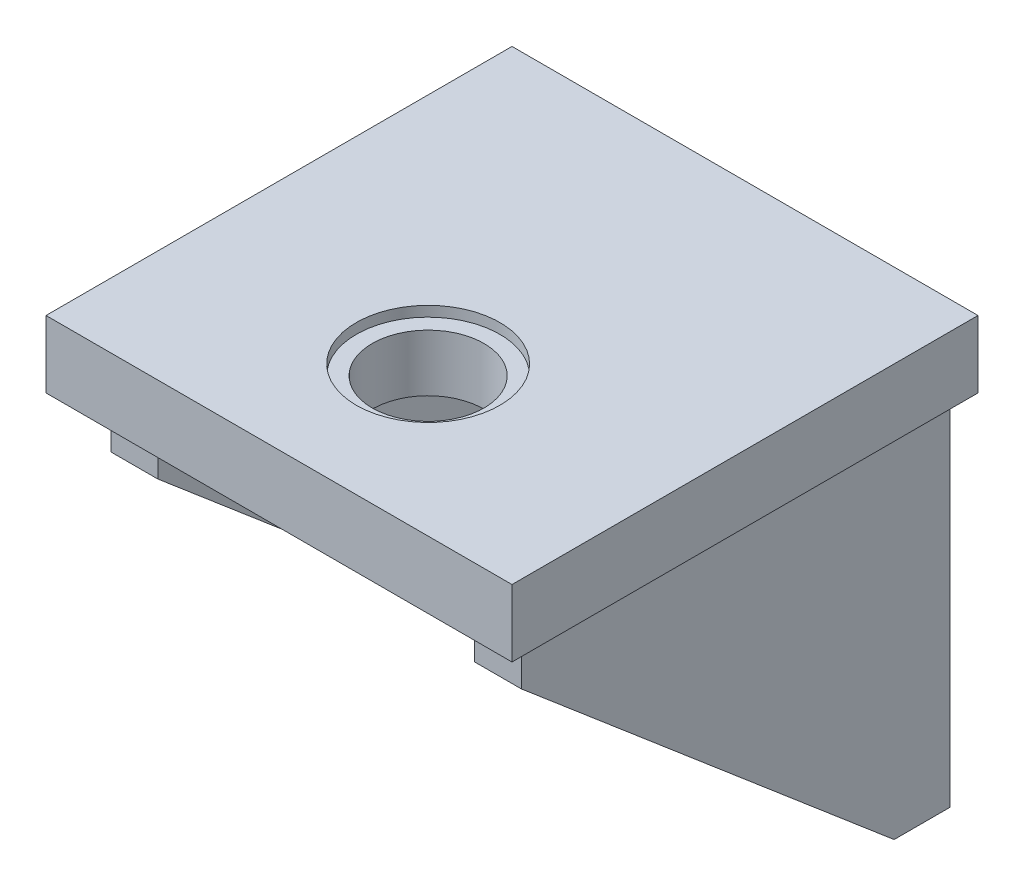
from build123d import *

# Parameters (mm, degrees)
SKETCH_1_W          = 250
SKETCH_1_H          = 250
EXTRUDE_1_DEPTH     = 36
CUT_EXTRUDE_1_REACH = 357.381
SKETCH_2_R          = 30
SKETCH_3_R          = 38.5
CUT_EXTRUDE_2_DEPTH = 5.5
SKETCH_4_W          = 25
SKETCH_4_H          = 230
EXTRUDE_2_DEPTH     = 200
CUT_EXTRUDE_3_REACH = 399.146


with BuildPart() as part:
    # 草图1 → 凸台-拉伸1 (new body)
    with BuildSketch(Plane(origin=(0, 0, 0), x_dir=(1, 0, 0), z_dir=(0, 1, 0))):
        with Locations((125, -125)):
            Rectangle(SKETCH_1_W, SKETCH_1_H)
    extrude(amount=EXTRUDE_1_DEPTH)

    # 草图2 → 切除-拉伸1 (cut, up to next)
    with BuildSketch(Plane(origin=(0, 36, 0), x_dir=(1, 0, 0), z_dir=(0, 1, 0)), mode=Mode.PRIVATE) as cut_extrude_1_sk1:
        with Locations(Location((125, -170, 0), (0, 0, 270))):
            Circle(SKETCH_2_R)
    cut_extrude_1_tool1 = extrude(cut_extrude_1_sk1.sketch, amount=-CUT_EXTRUDE_1_REACH, mode=Mode.PRIVATE) & part.part
    add(cut_extrude_1_tool1.solids().sort_by_distance((125, 36, 170))[0], mode=Mode.SUBTRACT)

    # 草图3 → 切除-拉伸2 (cut)
    with BuildSketch(Plane(origin=(0, 36, 0), x_dir=(1, 0, 0), z_dir=(0, 1, 0))):
        with Locations(Location((125, -170, 0), (0, 0, 270))):
            Circle(SKETCH_3_R)
    extrude(amount=-CUT_EXTRUDE_2_DEPTH, mode=Mode.SUBTRACT)

    # 草图4 → 凸台-拉伸2 (add)
    with BuildSketch(Plane.XZ):
        with Locations((27.5, 115)):
            Rectangle(SKETCH_4_W, SKETCH_4_H)
    extrude_2 = extrude(amount=EXTRUDE_2_DEPTH)

    # 草图5 → 切除-拉伸3 (cut, up to next)
    with BuildSketch(Plane.ZY.offset(-15), mode=Mode.PRIVATE) as cut_extrude_3_sk1:
        Polygon((30, -200), (230, -30), (230, -200), align=None)
    cut_extrude_3_tool1 = extrude(cut_extrude_3_sk1.sketch, amount=-CUT_EXTRUDE_3_REACH, mode=Mode.PRIVATE) & part.part
    cut_extrude_3 = cut_extrude_3_tool1.solids().sort_by_distance((15, -143.333333, 163.333333))[0]
    add(cut_extrude_3, mode=Mode.SUBTRACT)

    # 镜向1: 凸台-拉伸2, 切除-拉伸3 across plane
    add(extrude_2.mirror(Plane(origin=(125, 0, 0), x_dir=(0, 0, 1), z_dir=(1, 0, 0))))
    add(cut_extrude_3.mirror(Plane(origin=(125, 0, 0), x_dir=(0, 0, 1), z_dir=(1, 0, 0))), mode=Mode.SUBTRACT)


solid = part.part
